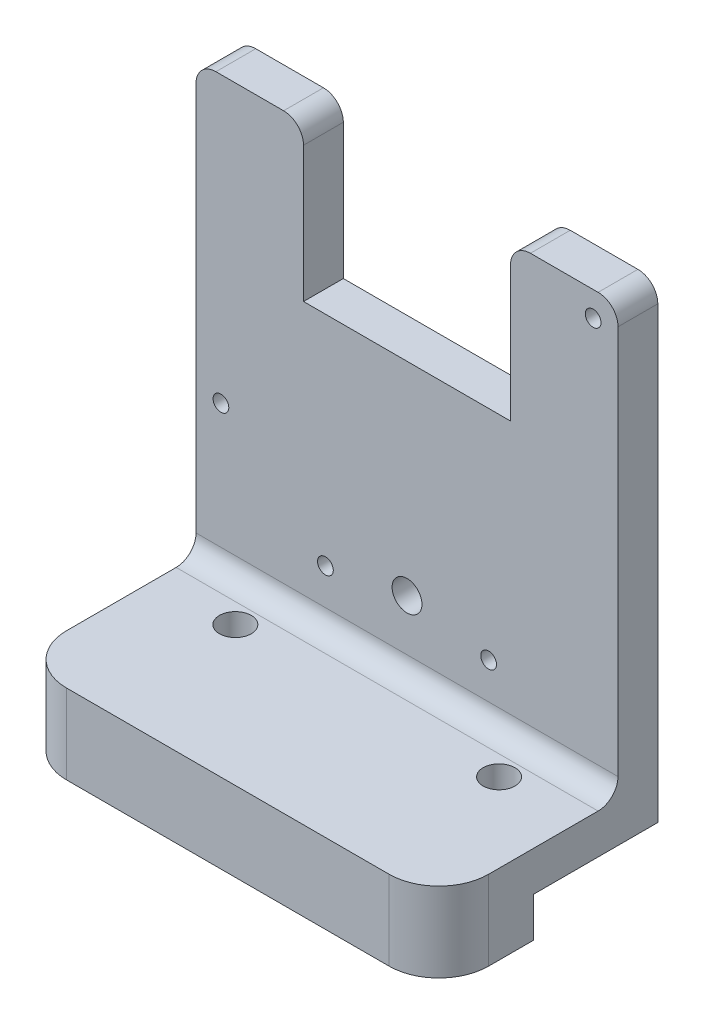
from build123d import *

# Parameters (mm, degrees)
BOSS_EXTRUDE1_DEPTH = 26.924
SKETCH2_R           = 1.0033
SKETCH2_R_2         = 1.905
CUT_EXTRUDE1_DEPTH  = 51.308
SKETCH3_W           = 26.416
SKETCH3_H           = 19.812
CUT_EXTRUDE2_DEPTH  = 5.08
FILLET1_R           = 6.35
FILLET2_R           = 2.54
FILLET3_R           = 2.54
SKETCH4_R           = 2.032
CUT_EXTRUDE3_DEPTH  = 66.185768423


with BuildPart() as part:
    # Sketch1 → Boss-Extrude1 (new, symmetric)
    with BuildSketch(Plane(origin=(0, 0, 0), x_dir=(0, 0, -1), z_dir=(1, 0, 0))):
        Polygon((-10.795, -34.4678), (5.08, -34.4678), (5.08, 25.4), (0, 25.4), (0, -29.3878), (-22.86, -29.3878), (-22.86, -39.5478), (-10.795, -39.5478), align=None)
    extrude(amount=BOSS_EXTRUDE1_DEPTH, both=True)

    # Sketch2 → Cut-Extrude1 (cut)
    with BuildSketch(Plane.XY):
        with Locations((23.749, 22.225)):
            Circle(SKETCH2_R)
        with Locations((-10.414, -22.225)):
            Circle(SKETCH2_R)
        with Locations((10.414, -22.225)):
            Circle(SKETCH2_R)
        with Locations((0, -20.32)):
            Circle(SKETCH2_R_2)
        with Locations((-23.749, -10.922)):
            Circle(SKETCH2_R)
    extrude(amount=-CUT_EXTRUDE1_DEPTH, mode=Mode.SUBTRACT)

    # Sketch3 → Cut-Extrude2 (cut)
    with BuildSketch(Plane.XY):
        with Locations((0, 15.494)):
            Rectangle(SKETCH3_W, SKETCH3_H)
    extrude(amount=-CUT_EXTRUDE2_DEPTH, mode=Mode.SUBTRACT)

    # Fillet1
    fillet1_edges = [part.edges().sort_by_distance(p)[0] for p in [
        (26.924, -34.4678, 22.86),
        (-26.924, -34.4678, 22.86),
    ]]
    fillet(fillet1_edges, radius=FILLET1_R)

    # Fillet2
    fillet2_edges = [part.edges().sort_by_distance(p)[0] for p in [
        (26.924, 25.4, -2.54),
        (-13.208, 25.4, -2.54),
        (13.208, 25.4, -2.54),
        (-26.924, 25.4, -2.54),
    ]]
    fillet(fillet2_edges, radius=FILLET2_R)

    # Fillet3
    fillet3_edges = [part.edges().sort_by_distance(p)[0] for p in [
        (0, -29.3878, 0),
    ]]
    fillet(fillet3_edges, radius=FILLET3_R)

    # Sketch4 → Cut-Extrude3 (cut, through all)
    with BuildSketch(Plane(origin=(0, -29.3878, 0), x_dir=(1, 0, 0), z_dir=(0, 1, 0))):
        with Locations(Location((-16.8275, -5.08, 0), (0, 0, 270))):
            Circle(SKETCH4_R)
        with Locations(Location((16.8275, -5.08, 0), (0, 0, 270))):
            Circle(SKETCH4_R)
    extrude(amount=-CUT_EXTRUDE3_DEPTH, mode=Mode.SUBTRACT)


solid = part.part
